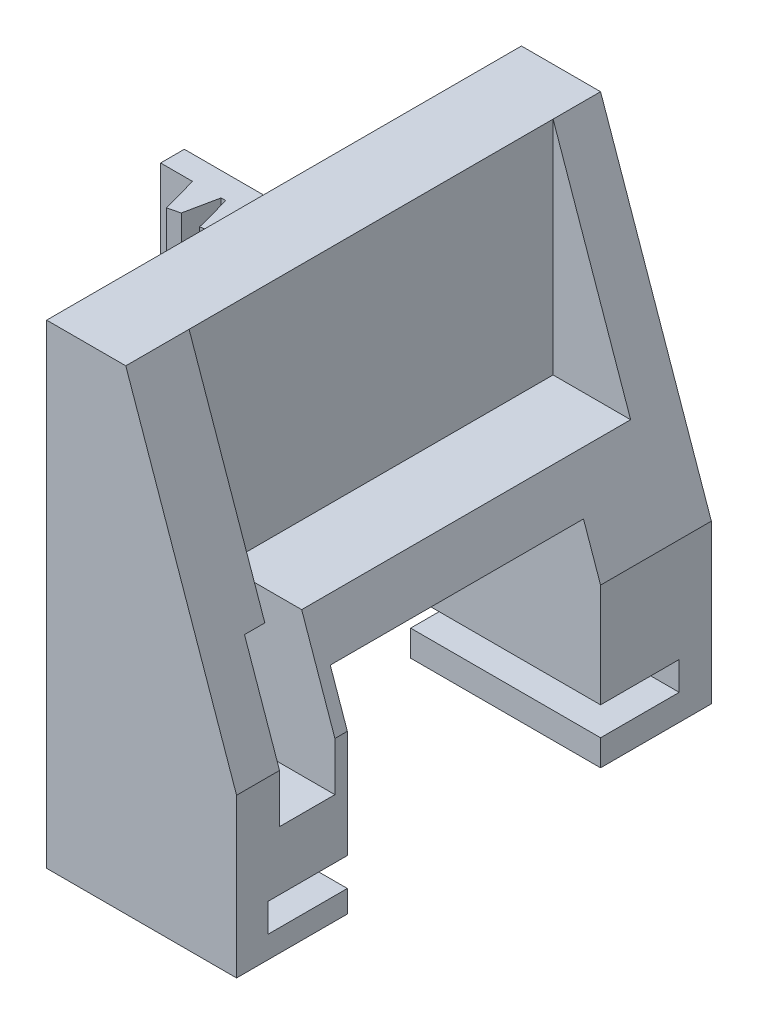
from build123d import *

# Parameters (mm, degrees)
BOSS_EXTRUDE1_DEPTH = 30
SKETCH4_W           = 16
SKETCH4_H           = 14
CUT_EXTRUDE2_DEPTH  = 25
SKETCH5_W           = 5
SKETCH5_H           = 1.8
CUT_EXTRUDE3_DEPTH  = 15
CUT_EXTRUDE4_DEPTH  = 11.5
BOSS_EXTRUDE2_DEPTH = 8
SKETCH8_W           = 3.5
SKETCH8_H           = 9.4
CUT_EXTRUDE5_DEPTH  = 47.486557197
SKETCH9_W           = 5
SKETCH9_H           = 1.8
CUT_EXTRUDE6_DEPTH  = 47.486557197


with BuildPart() as part:
    # Sketch1 → Boss-Extrude1 (new body)
    with BuildSketch(Plane.XY):
        Polygon((0, 0), (0, -30), (12, -30), (12, -20), (5, 0), align=None)
    extrude(amount=-BOSS_EXTRUDE1_DEPTH)

    # Sketch4 → Cut-Extrude2 (cut)
    with BuildSketch(Plane.ZY):
        with Locations((-15, -23.917856259)):
            Rectangle(SKETCH4_W, SKETCH4_H)
    extrude(amount=-CUT_EXTRUDE2_DEPTH, mode=Mode.SUBTRACT)

    # Sketch5 → Cut-Extrude3 (cut)
    with BuildSketch(Plane.ZY):
        with Locations((-4.5, -27.7)):
            Rectangle(SKETCH5_W, SKETCH5_H)
    extrude(amount=-CUT_EXTRUDE3_DEPTH, mode=Mode.SUBTRACT)

    # Sketch6 → Cut-Extrude4 (cut, symmetric)
    with BuildSketch(Plane.XY.offset(-15.5)):
        Polygon((5, 0), (5, -14), (9.9, -14), align=None)
    extrude(amount=CUT_EXTRUDE4_DEPTH, both=True, mode=Mode.SUBTRACT)

    # Sketch7 → Boss-Extrude2 (add)
    with BuildSketch(Plane(origin=(0, -22, 0), x_dir=(1, 0, 0), z_dir=(0, 1, 0))):
        with BuildLine():
            Line((0, 27.7), (-19, 27.7))
            Line((-19, 27.7), (-19, 26.2))
            Line((-19, 26.2), (-16.993455994, 26.2))
            ThreePointArc((-16.993455994, 26.2), (-16.6644108, 25.067952934), (-16.365476207, 23.927584833))
            Line((-16.365476207, 23.927584833), (-15.609396851, 24.115112691))
            Line((-15.609396851, 24.115112691), (-15.179008189, 26.2))
            Line((-15.179008189, 26.2), (-14.896454824, 26.2))
            ThreePointArc((-14.896454824, 26.2), (-14.56740963, 25.067952934), (-14.268475038, 23.927584833))
            Line((-14.268475038, 23.927584833), (-13.512395681, 24.115112691))
            Line((-13.512395681, 24.115112691), (-13.082007019, 26.2))
            Line((-13.082007019, 26.2), (-12.799453654, 26.2))
            ThreePointArc((-12.799453654, 26.2), (-12.470408461, 25.067952934), (-12.171473868, 23.927584833))
            Line((-12.171473868, 23.927584833), (-11.415394512, 24.115112691))
            Line((-11.415394512, 24.115112691), (-10.985005849, 26.2))
            Line((-10.985005849, 26.2), (-10.702452484, 26.2))
            ThreePointArc((-10.702452484, 26.2), (-10.373407291, 25.067952934), (-10.074472698, 23.927584833))
            Line((-10.074472698, 23.927584833), (-9.318393342, 24.115112691))
            Line((-9.318393342, 24.115112691), (-8.888004679, 26.2))
            Line((-8.888004679, 26.2), (-8.605451315, 26.2))
            ThreePointArc((-8.605451315, 26.2), (-8.276406121, 25.067952934), (-7.977471528, 23.927584833))
            Line((-7.977471528, 23.927584833), (-7.221392172, 24.115112691))
            Line((-7.221392172, 24.115112691), (-6.791003509, 26.2))
            Line((-6.791003509, 26.2), (-6.508450145, 26.2))
            ThreePointArc((-6.508450145, 26.2), (-6.179404951, 25.067952934), (-5.880470358, 23.927584833))
            Line((-5.880470358, 23.927584833), (-5.124391002, 24.115112691))
            Line((-5.124391002, 24.115112691), (-4.69400234, 26.2))
            Line((-4.69400234, 26.2), (-4.411448975, 26.2))
            ThreePointArc((-4.411448975, 26.2), (-4.082403781, 25.067952934), (-3.783469189, 23.927584833))
            Line((-3.783469189, 23.927584833), (-3.027389832, 24.115112691))
            Line((-3.027389832, 24.115112691), (-2.59700117, 26.2))
            Line((-2.59700117, 26.2), (-2.314447805, 26.2))
            ThreePointArc((-2.314447805, 26.2), (-1.985402612, 25.067952934), (-1.686468019, 23.927584833))
            Line((-1.686468019, 23.927584833), (-0.930388662, 24.115112691))
            Line((-0.930388662, 24.115112691), (-0.5, 26.2))
            Line((-0.5, 26.2), (0, 26.2))
            Line((0, 26.2), (0, 27.7))
        make_face()
    extrude(amount=BOSS_EXTRUDE2_DEPTH)

    # Sketch8 → Cut-Extrude5 (cut, through all)
    with BuildSketch(Plane.ZY):
        with Locations((-4.464057862, -18.374722701)):
            Rectangle(SKETCH8_W, SKETCH8_H)
    extrude(amount=-CUT_EXTRUDE5_DEPTH, mode=Mode.SUBTRACT)

    # Sketch9 → Cut-Extrude6 (cut, through all)
    with BuildSketch(Plane.ZY):
        with Locations((-25.470383714, -27.453702253)):
            Rectangle(SKETCH9_W, SKETCH9_H)
    extrude(amount=-CUT_EXTRUDE6_DEPTH, mode=Mode.SUBTRACT)


solid = part.part
